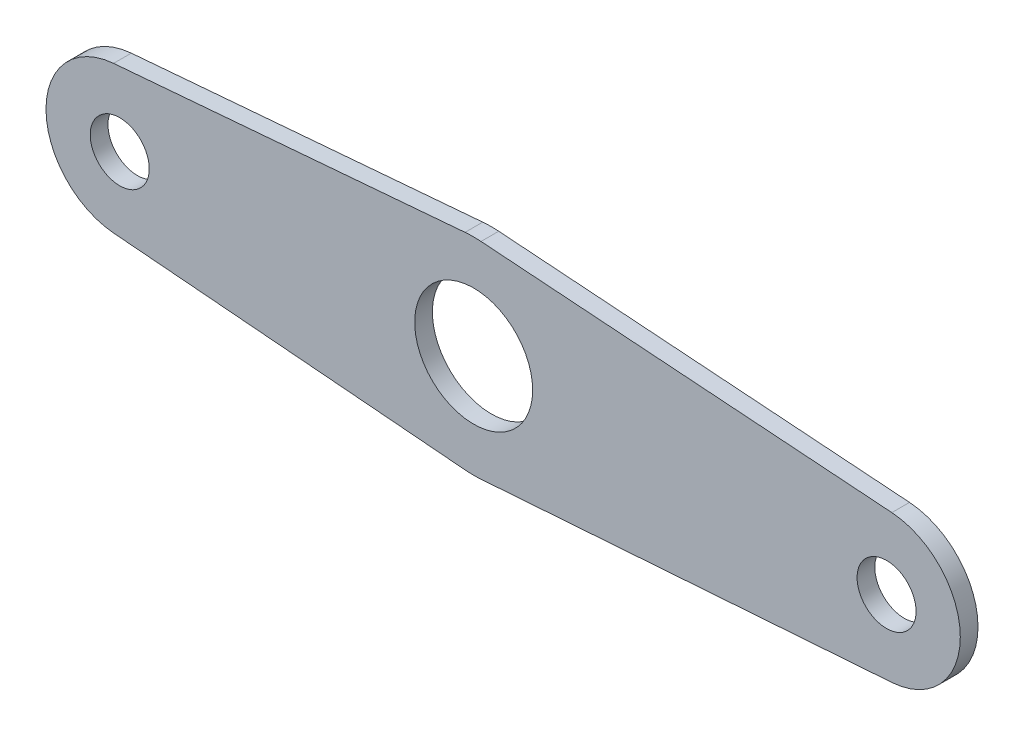
from build123d import *

# Parameters (mm, degrees)
SCHIZZO1_R                   = 5
SCHIZZO1_R_2                 = 10
ESTRUSIONE_ESTRUSIONE1_DEPTH = 3


with BuildPart() as part:
    # Schizzo1 → Estrusione-Estrusione1 (new body)
    with BuildSketch(Plane.XY):
        with BuildLine():
            Line((-61.041666667, 12.456521607), (-1.458333333, 17.43913025))
            ThreePointArc((-1.458333333, 17.43913025), (-0.104479951, 17.49968811), (1.25, 17.455300055))
            Line((1.25, 17.455300055), (70.892857143, 12.468071468))
            ThreePointArc((70.892857143, 12.468071468), (82.5, 0), (70.892857143, -12.468071468))
            Line((70.892857143, -12.468071468), (1.25, -17.455300055))
            ThreePointArc((1.25, -17.455300055), (-0.104479951, -17.49968811), (-1.458333333, -17.43913025))
            Line((-1.458333333, -17.43913025), (-61.041666667, -12.456521607))
            ThreePointArc((-61.041666667, -12.456521607), (-72.5, 0), (-61.041666667, 12.456521607))
        make_face()
        with Locations((-60, 0)):
            Circle(SCHIZZO1_R, mode=Mode.SUBTRACT)
        Circle(SCHIZZO1_R_2, mode=Mode.SUBTRACT)
        with Locations((70, 0)):
            Circle(SCHIZZO1_R, mode=Mode.SUBTRACT)
    extrude(amount=ESTRUSIONE_ESTRUSIONE1_DEPTH)


solid = part.part
